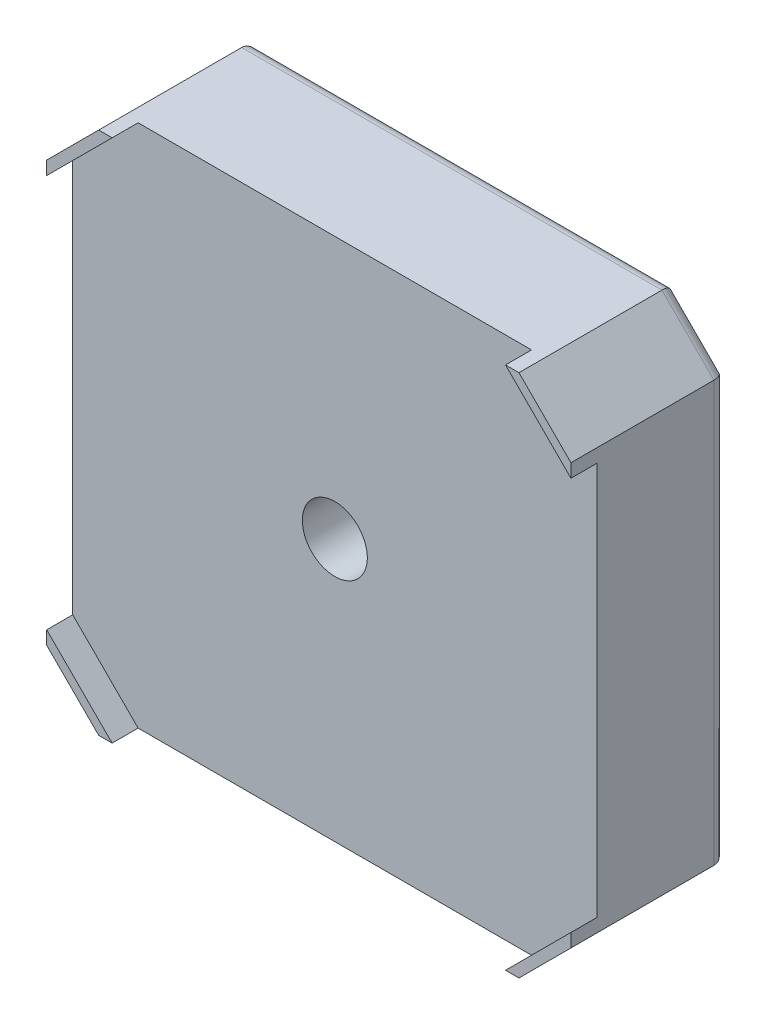
from build123d import *

# Parameters (mm, degrees)
BOSS_EXTRUDE1_DEPTH = 36
CUT_EXTRUDE1_DEPTH  = 6
SKETCH3_R           = 33
BOSS_EXTRUDE2_DEPTH = 6
SKETCH4_R           = 16.5
CUT_EXTRUDE2_DEPTH  = 21
SKETCH5_R           = 7.5
CUT_EXTRUDE3_DEPTH  = 89.099375707
FILLET1_R           = 3
FILLET2_R           = 1.5
SKETCH6_R           = 4.5
CUT_EXTRUDE4_DEPTH  = 9
FILLET3_R           = 1.5
ESCALA2_SCALE       = 0.5


with BuildPart() as part:
    # Sketch1 → Boss-Extrude1 (new body)
    with BuildSketch(Plane.XY):
        Polygon((-48.5, 60.5), (-60.5, 48.5), (-60.5, -48.5), (-48.5, -60.5), (48.5, -60.5), (60.5, -48.5), (60.5, 48.5), (48.5, 60.5), align=None)
    extrude(amount=BOSS_EXTRUDE1_DEPTH)

    # Sketch2 → Cut-Extrude1 (cut)
    with BuildSketch(Plane.XY.offset(36)):
        Polygon((-42.45, 63.45), (-63.45, 42.45), (-63.45, -42.45), (-42.45, -63.45), (42.45, -63.45), (63.45, -42.45), (63.45, 42.45), (42.45, 63.45), align=None)
    extrude(amount=-CUT_EXTRUDE1_DEPTH, mode=Mode.SUBTRACT)

    # Sketch3 → Boss-Extrude2 (add)
    with BuildSketch(Plane(origin=(0, 0, 0), x_dir=(-1, 0, 0), z_dir=(0, 0, -1))):
        Circle(SKETCH3_R)
    extrude(amount=BOSS_EXTRUDE2_DEPTH)

    # Sketch4 → Cut-Extrude2 (cut)
    with BuildSketch(Plane(origin=(0, 0, -6), x_dir=(-1, 0, 0), z_dir=(0, 0, -1))):
        Circle(SKETCH4_R)
    extrude(amount=-CUT_EXTRUDE2_DEPTH, mode=Mode.SUBTRACT)

    # Sketch5 → Cut-Extrude3 (cut, through all)
    with BuildSketch(Plane(origin=(0, 0, 15), x_dir=(-1, 0, 0), z_dir=(0, 0, -1))):
        Circle(SKETCH5_R)
    extrude(amount=-CUT_EXTRUDE3_DEPTH, mode=Mode.SUBTRACT)

    # Fillet1
    fillet1_edges = [part.edges().sort_by_distance(p)[0] for p in [
        (-54.5, 54.5, 0),
        (0, 60.5, 0),
        (54.5, 54.5, 0),
        (60.5, 0, 0),
        (54.5, -54.5, 0),
        (0, -60.5, 0),
        (-54.5, -54.5, 0),
        (-60.5, 0, 0),
    ]]
    fillet(fillet1_edges, radius=FILLET1_R)

    # Fillet2
    fillet2_edges = [part.edges().sort_by_distance(p)[0] for p in [
        (33, 0, -6),
        (16.5, 0, 15),
        (16.5, 0, -6),
    ]]
    fillet(fillet2_edges, radius=FILLET2_R)

    # Sketch6 → Cut-Extrude4 (cut)
    with BuildSketch(Plane(origin=(0, 0, 0), x_dir=(-1, 0, 0), z_dir=(0, 0, -1))):
        with Locations((-46.5, 46.5)):
            Circle(SKETCH6_R)
        with Locations((46.5, 46.5)):
            Circle(SKETCH6_R)
        with Locations((46.5, -46.5)):
            Circle(SKETCH6_R)
        with Locations((-46.5, -46.5)):
            Circle(SKETCH6_R)
    extrude(amount=-CUT_EXTRUDE4_DEPTH, mode=Mode.SUBTRACT)

    # Fillet3
    fillet3_edges = [part.edges().sort_by_distance(p)[0] for p in [
        (51, -46.5, 0),
        (-42, -46.5, 0),
        (-42, 46.5, 0),
        (51, 46.5, 0),
    ]]
    fillet(fillet3_edges, radius=FILLET3_R)


with BuildPart() as part_1:
    # Escala2: scaled about (0, 0, 14.668039621)
    add(part.part.scale(ESCALA2_SCALE).moved(Location((0, 0, 7.334019811))))


solid = part_1.part
